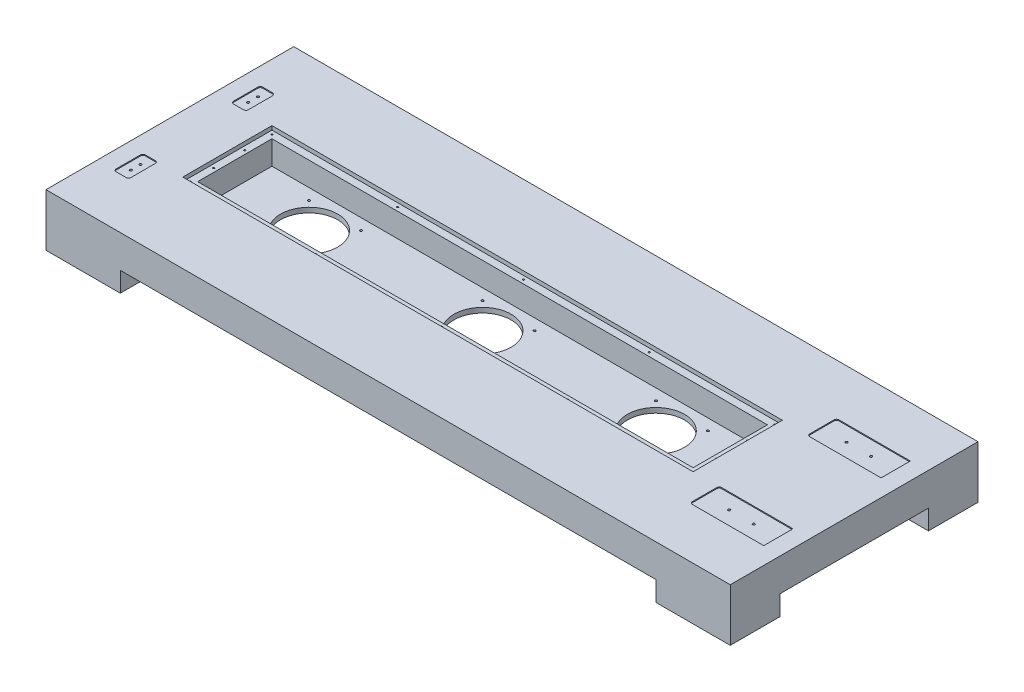
from build123d import *

# Parameters (mm, degrees)
SKETCH19_W               = 1030
SKETCH19_H               = 180
SKETCH19_W_2             = 1000
SKETCH19_H_2             = 150
BOSS_EXTRUDE2_DEPTH      = 48
SKETCH22_W               = 1030
SKETCH22_H               = 180
BOSS_EXTRUDE3_DEPTH      = 10
BOSS_EXTRUDE4_DEPTH      = 56
BOSS_EXTRUDE4_DEPTH_BACK = 10
SKETCH23_W               = 1500
SKETCH23_H               = 500
SKETCH23_W_2             = 1030
SKETCH23_H_2             = 180
CUT_EXTRUDE6_START       = 48
SKETCH26_R               = 1.65
CUT_EXTRUDE6_DEPTH       = 20
LPATTERN1_COUNT          = 5
LPATTERN1_PITCH          = 253.75
SKETCH28_R               = 2.3
SKETCH28_R_2             = 57.7
CUT_EXTRUDE7_DEPTH       = 793.55031386
LPATTERN2_COUNT          = 2
LPATTERN2_PITCH          = 350
LPATTERN2_COL_COUNT      = 2
LPATTERN2_COL_PITCH      = 350
CUT_EXTRUDE8_START       = 48
SKETCH27_R               = 1.65
CUT_EXTRUDE8_DEPTH       = 20
CUT_EXTRUDE9_START       = -56
CUT_EXTRUDE9_DEPTH       = 2
CUT_EXTRUDE10_START      = 56
CUT_EXTRUDE10_DEPTH      = 2
CUT_EXTRUDE11_DEPTH      = 793.55031386
CUT_EXTRUDE11_DEPTH_BACK = 793.55031386
SKETCH33_R               = 2.35
CUT_EXTRUDE12_DEPTH      = 793.55031386
CUT_EXTRUDE12_DEPTH_BACK = 793.55031386
SKETCH34_W               = 190.830831748
SKETCH34_H               = 540.530008981
SKETCH29_W               = 150
SKETCH29_H               = 100
BOSS_EXTRUDE5_DEPTH      = 50


with BuildPart() as part:
    # Sketch19 → Boss-Extrude2 (new body)
    with BuildSketch(Plane(origin=(0, 0, 0), x_dir=(1, 0, 0), z_dir=(0, 1, 0))):
        Rectangle(SKETCH19_W, SKETCH19_H)
        Rectangle(SKETCH19_W_2, SKETCH19_H_2, mode=Mode.SUBTRACT)
    extrude(amount=BOSS_EXTRUDE2_DEPTH)

    # Sketch22 → Boss-Extrude3 (add)
    with BuildSketch(Plane(origin=(0, 0, 0), x_dir=(1, 0, 0), z_dir=(0, 1, 0))):
        Rectangle(SKETCH22_W, SKETCH22_H)
    extrude(amount=-BOSS_EXTRUDE3_DEPTH)

    # Sketch23 → Boss-Extrude4 (add, two sides: drawn at the far end of the back side and taken through both)
    with BuildSketch(Plane(origin=(0, 0, 0), x_dir=(1, 0, 0), z_dir=(0, 1, 0)).offset(-BOSS_EXTRUDE4_DEPTH_BACK)):
        Rectangle(SKETCH23_W, SKETCH23_H)
        Rectangle(SKETCH23_W_2, SKETCH23_H_2, mode=Mode.SUBTRACT)
    extrude(amount=BOSS_EXTRUDE4_DEPTH + BOSS_EXTRUDE4_DEPTH_BACK)

    # Sketch26 → Cut-Extrude6 (cut)
    with BuildSketch(Plane(origin=(0, 0, 0), x_dir=(1, 0, 0), z_dir=(0, 1, 0)).offset(CUT_EXTRUDE6_START)):
        with Locations(Location((-507.5, -82.5, 0), (0, 0, 90))):
            Circle(SKETCH26_R)
        with Locations(Location((-507.5, 82.5, 0), (0, 0, 90))):
            Circle(SKETCH26_R)
    cut_extrude6 = extrude(amount=-CUT_EXTRUDE6_DEPTH, mode=Mode.SUBTRACT)

    # LPattern1: Cut-Extrude6 ×5
    with Locations(*[(i * LPATTERN1_PITCH, 0, 0) for i in range(1, LPATTERN1_COUNT)]):
        add(cut_extrude6, mode=Mode.SUBTRACT)

    # Sketch28 → Cut-Extrude7 (cut, symmetric)
    with BuildSketch(Plane(origin=(0, 0, 0), x_dir=(1, 0, 0), z_dir=(0, 1, 0))):
        with Locations(Location((-52.5, 52.5, 0), (0, 0, 270))):
            Circle(SKETCH28_R)
        with Locations(Location((52.5, 52.5, 0), (0, 0, 270))):
            Circle(SKETCH28_R)
        with Locations(Location((52.5, -52.5, 0), (0, 0, 270))):
            Circle(SKETCH28_R)
        with Locations(Location((-52.5, -52.5, 0), (0, 0, 270))):
            Circle(SKETCH28_R)
        with Locations(Location((0, 0, 0), (0, 0, 270))):
            Circle(SKETCH28_R_2)
    cut_extrude7 = extrude(amount=CUT_EXTRUDE7_DEPTH, both=True, mode=Mode.SUBTRACT)

    # LPattern2: Cut-Extrude7 ×2
    with Locations(*[(-i * LPATTERN2_PITCH, 0, 0) for i in range(1, LPATTERN2_COUNT)]):
        add(cut_extrude7, mode=Mode.SUBTRACT)

    # LPattern2 col: Cut-Extrude7 ×2
    with Locations(*[(i * LPATTERN2_COL_PITCH, 0, 0) for i in range(1, LPATTERN2_COL_COUNT)]):
        add(cut_extrude7, mode=Mode.SUBTRACT)

    # Sketch27 → Cut-Extrude8 (cut)
    with BuildSketch(Plane(origin=(0, 0, 0), x_dir=(1, 0, 0), z_dir=(0, 1, 0)).offset(CUT_EXTRUDE8_START)):
        with Locations(Location((-507.5, 27.5, 0), (0, 0, 90))):
            Circle(SKETCH27_R)
        with Locations(Location((-507.5, -35, 0), (0, 0, 90))):
            Circle(SKETCH27_R)
        with Locations(Location((507.5, -35, 0), (0, 0, 90))):
            Circle(SKETCH27_R)
        with Locations(Location((507.5, 27.5, 0), (0, 0, 90))):
            Circle(SKETCH27_R)
    extrude(amount=-CUT_EXTRUDE8_DEPTH, mode=Mode.SUBTRACT)

    # Sketch30 → Cut-Extrude9 (cut)
    with BuildSketch(Plane.XZ.offset(CUT_EXTRUDE9_START)):
        with BuildLine():
            Line((571.5, -147.92), (714.5, -147.92))
            ThreePointArc((714.5, -147.92), (715.207106781, -147.627106781), (715.5, -146.92))
            Line((715.5, -146.92), (715.5, -89.92))
            ThreePointArc((715.5, -89.92), (715.207106781, -89.212893219), (714.5, -88.92))
            Line((714.5, -88.92), (571.5, -88.92))
            ThreePointArc((571.5, -88.92), (567.964466094, -90.384466094), (566.5, -93.92))
            Line((566.5, -93.92), (566.5, -142.92))
            ThreePointArc((566.5, -142.92), (567.964466094, -146.455533906), (571.5, -147.92))
        make_face()
    cut_extrude9 = extrude(amount=CUT_EXTRUDE9_DEPTH, mode=Mode.SUBTRACT)

    # Mirror1: Cut-Extrude9 across plane
    add(cut_extrude9.mirror(Plane.XY), mode=Mode.SUBTRACT)

    # Sketch32 → Cut-Extrude10 (cut)
    with BuildSketch(Plane(origin=(0, 0, 0), x_dir=(1, 0, 0), z_dir=(0, 1, 0)).offset(CUT_EXTRUDE10_START)):
        with BuildLine():
            Line((-591.5, 147.92), (-571.5, 147.92))
            ThreePointArc((-571.5, 147.92), (-567.964466094, 146.455533906), (-566.5, 142.92))
            Line((-566.5, 142.92), (-566.5, 93.92))
            ThreePointArc((-566.5, 93.92), (-567.964466094, 90.384466094), (-571.5, 88.92))
            Line((-571.5, 88.92), (-591.5, 88.92))
            ThreePointArc((-591.5, 88.92), (-595.035533906, 90.384466094), (-596.5, 93.92))
            Line((-596.5, 93.92), (-596.5, 142.92))
            ThreePointArc((-596.5, 142.92), (-595.035533906, 146.455533906), (-591.5, 147.92))
        make_face()
    cut_extrude10 = extrude(amount=-CUT_EXTRUDE10_DEPTH, mode=Mode.SUBTRACT)

    # Mirror2: Cut-Extrude10 across plane
    add(cut_extrude10.mirror(Plane.XY), mode=Mode.SUBTRACT)

    # Sketch33 → Cut-Extrude11 (cut, two sides: drawn at the far end of the back side and taken through both)
    with BuildSketch(Plane(origin=(0, 0, 0), x_dir=(1, 0, 0), z_dir=(0, 1, 0)).offset(-CUT_EXTRUDE11_DEPTH_BACK)):
        with Locations(Location((-581.5, 108.58, 0), (0, 0, 270))):
            Circle(SKETCH33_R)
        with Locations(Location((-581.5, -108.59, 0), (0, 0, 270))):
            Circle(SKETCH33_R)
        with Locations(Location((-581.5, 128.25, 0), (0, 0, 270))):
            Circle(SKETCH33_R)
        with Locations(Location((-581.5, -128.26, 0), (0, 0, 270))):
            Circle(SKETCH33_R)
        with Locations(Location((616.17, -118.42, 0), (0, 0, 270))):
            Circle(SKETCH33_R)
        with Locations(Location((665.84, -118.42, 0), (0, 0, 270))):
            Circle(SKETCH33_R)
        with Locations(Location((616.17, 118.42, 0), (0, 0, 270))):
            Circle(SKETCH33_R)
        with Locations(Location((665.84, 118.42, 0), (0, 0, 270))):
            Circle(SKETCH33_R)
    extrude(amount=CUT_EXTRUDE11_DEPTH + CUT_EXTRUDE11_DEPTH_BACK, mode=Mode.SUBTRACT)

    # Sketch34 → Cut-Extrude12 (cut, two sides: drawn at the far end of the back side and taken through both)
    with BuildSketch(Plane(origin=(0, 0, 0), x_dir=(1, 0, 0), z_dir=(0, 1, 0)).offset(-CUT_EXTRUDE12_DEPTH_BACK)):
        with Locations((-726.415415874, 20.265004491)):
            Rectangle(SKETCH34_W, SKETCH34_H)
    extrude(amount=CUT_EXTRUDE12_DEPTH + CUT_EXTRUDE12_DEPTH_BACK, mode=Mode.SUBTRACT)

    # Sketch29 → Boss-Extrude5 (add)
    with BuildSketch(Plane(origin=(0, 0, 0), x_dir=(1, 0, 0), z_dir=(0, 1, 0))):
        with Locations((-556, -200)):
            Rectangle(SKETCH29_W, SKETCH29_H)
        with Locations((-556, 200)):
            Rectangle(SKETCH29_W, SKETCH29_H)
        with Locations((675, -200)):
            Rectangle(SKETCH29_W, SKETCH29_H)
        with Locations((675, 200)):
            Rectangle(SKETCH29_W, SKETCH29_H)
    extrude(amount=-BOSS_EXTRUDE5_DEPTH)


solid = part.part
